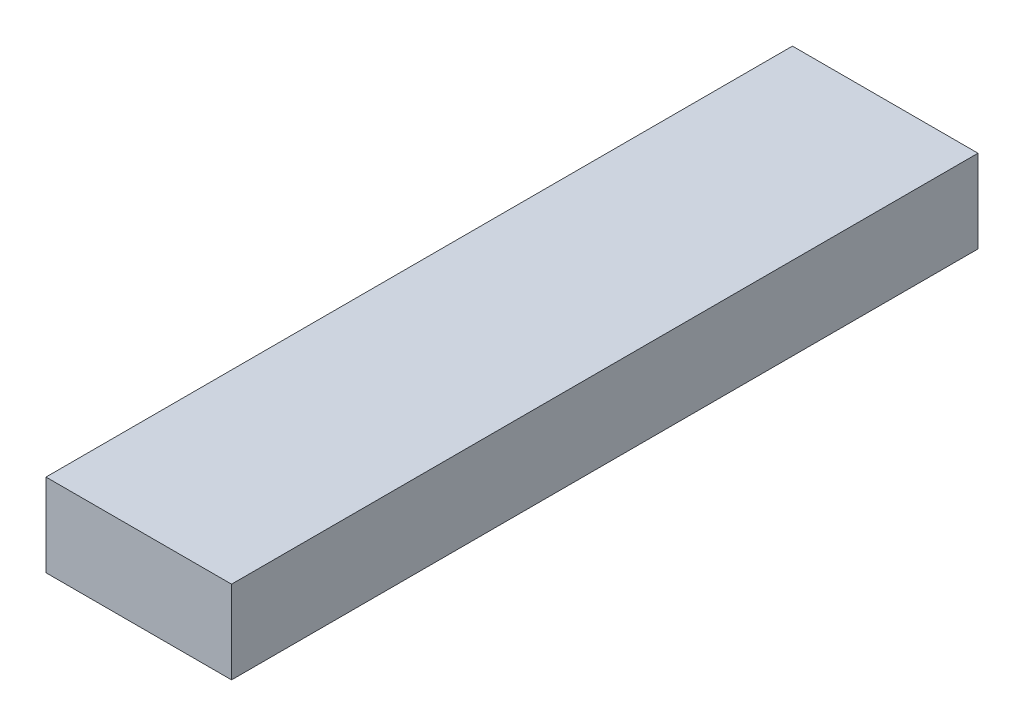
from build123d import *

# Parameters (mm, degrees)
SKETCH1_W           = 16.6624
SKETCH1_H           = 37.2872
BOSS_EXTRUDE1_DEPTH = 75


with BuildPart() as part:
    # Sketch1 → Boss-Extrude1 (new, symmetric)
    with BuildSketch(Plane(origin=(0, 0, 0), x_dir=(0, 1, 0), z_dir=(0, 0, 1))):
        Rectangle(SKETCH1_W, SKETCH1_H)
    extrude(amount=BOSS_EXTRUDE1_DEPTH, both=True)


solid = part.part
